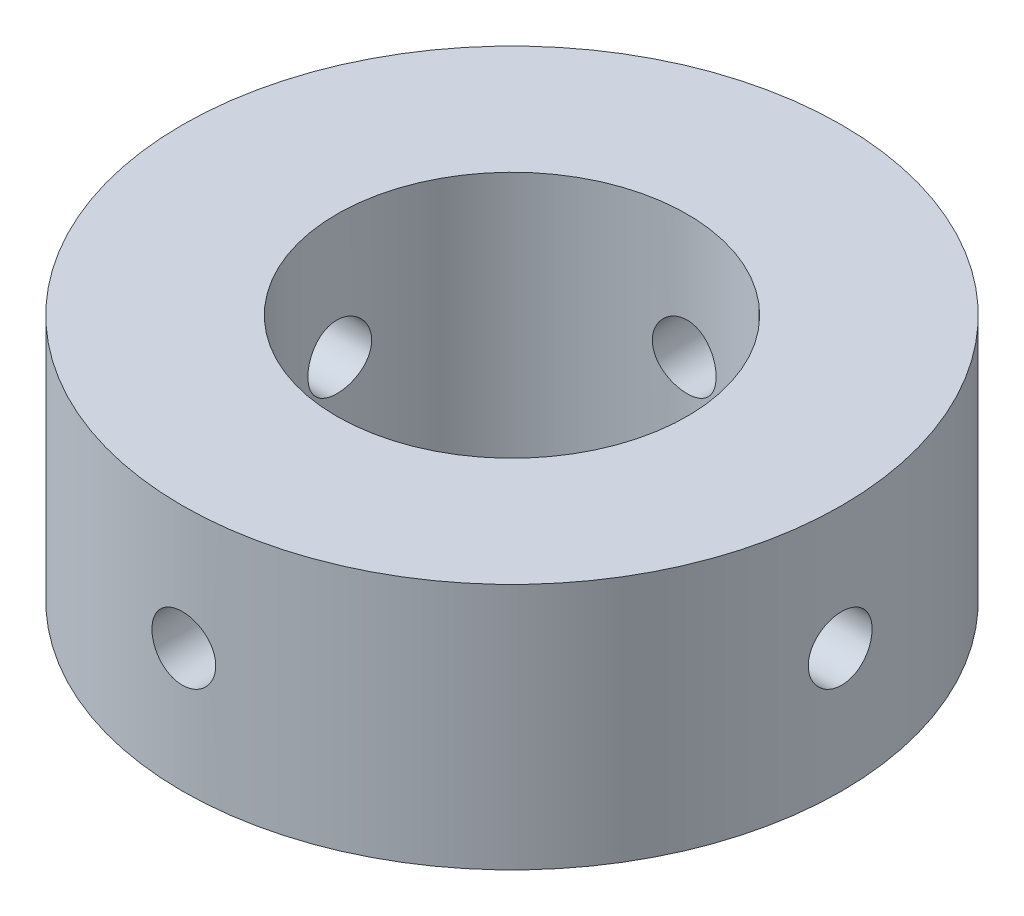
from build123d import *

# Parameters (mm, degrees)
SKETCH1_R                         = 25.4
SKETCH1_R_2                       = 13.49375
BOSS_EXTRUDE1_DEPTH               = 19.05
F_10_0_1935_DIAMETER_HOLE1_REACH  = 61.906
F_10_0_1935_DIAMETER_HOLE1_BORE_R = 2.45745
CIRPATTERN1_COUNT                 = 4


with BuildPart() as part:
    # Sketch1 → Boss-Extrude1 (new body)
    with BuildSketch(Plane(origin=(0, 0, 0), x_dir=(1, 0, 0), z_dir=(0, 1, 0))):
        with Locations(Location((0, 0, 0), (0, 0, 90))):
            Circle(SKETCH1_R)
        with Locations(Location((0, 0, 0), (0, 0, 90))):
            Circle(SKETCH1_R_2, mode=Mode.SUBTRACT)
    extrude(amount=BOSS_EXTRUDE1_DEPTH)

    # #10 (0.1935) Diameter Hole1 bore → #10 (0.1935) Diameter Hole1 (cut, up to next)
    with BuildSketch(Plane(origin=(25.4, 0, 0), x_dir=(0, 0, -1), z_dir=(1, 0, 0)), mode=Mode.PRIVATE) as f_10_0_1935_diameter_hole1_sk1:
        with Locations((0, 9.525)):
            Circle(F_10_0_1935_DIAMETER_HOLE1_BORE_R)
    f_10_0_1935_diameter_hole1_tool1 = extrude(f_10_0_1935_diameter_hole1_sk1.sketch, amount=-F_10_0_1935_DIAMETER_HOLE1_REACH, mode=Mode.PRIVATE) & part.part
    f_10_0_1935_diameter_hole1 = f_10_0_1935_diameter_hole1_tool1.solids().sort_by_distance((25.4, 9.525, 0))[0]
    add(f_10_0_1935_diameter_hole1, mode=Mode.SUBTRACT)

    # CirPattern1: #10 (0.1935) Diameter Hole1 ×4 about axis
    cirpattern1_axis = Axis((0, 19.05, 0), (0, -1, 0))
    for i in range(1, CIRPATTERN1_COUNT):
        add(f_10_0_1935_diameter_hole1.rotate(cirpattern1_axis, i * 360 / CIRPATTERN1_COUNT), mode=Mode.SUBTRACT)


solid = part.part
